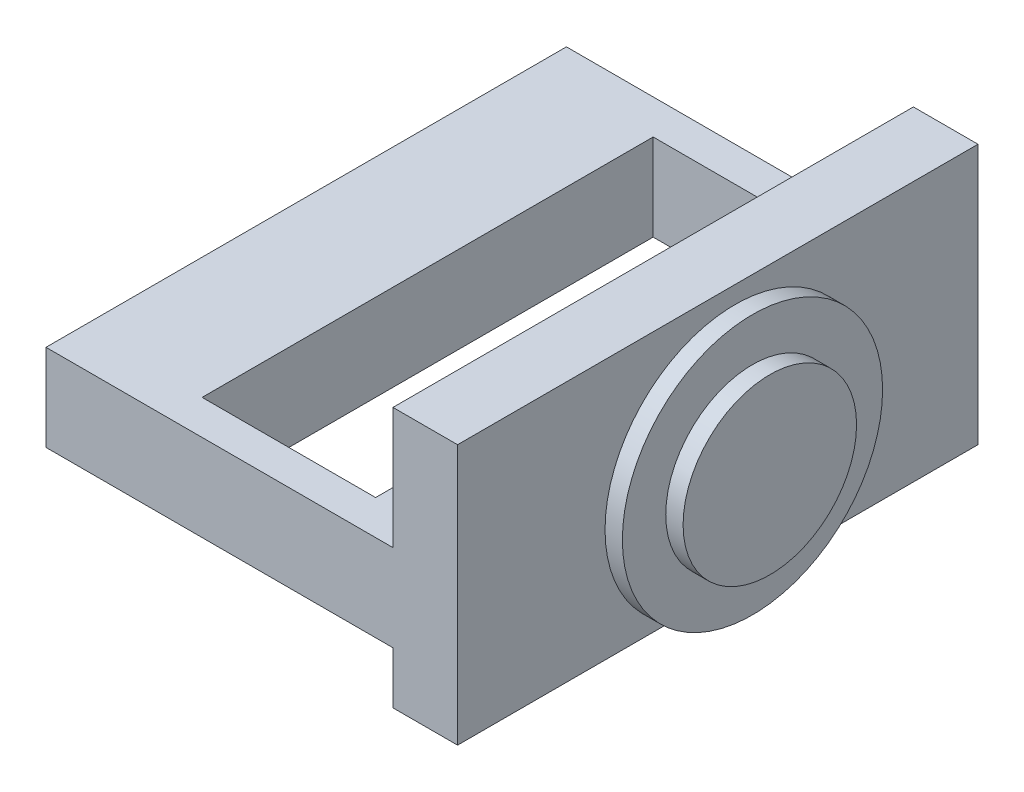
from build123d import *

# Parameters (mm, degrees)
BOSS_EXTRUDE1_DEPTH = 30
SKETCH3_W           = 10
SKETCH3_H           = 26
CUT_EXTRUDE1_DEPTH  = 5
SKETCH6_R           = 5
BOSS_EXTRUDE2_DEPTH = 1
SKETCH7_R           = 7.5
BOSS_EXTRUDE3_DEPTH = 1
SKETCH8_R           = 5
BOSS_EXTRUDE4_DEPTH = 1


with BuildPart() as part:
    # Sketch1 → Boss-Extrude1 (new body)
    with BuildSketch(Plane.XY):
        Polygon((-14.164814983, 3.151006711), (-14.164814983, -1.848993289), (5.835185017, -1.848993289), (5.835185017, -4.848993289), (9.560017232, -4.848993289), (9.560017232, 10.151006711), (5.835185017, 10.151006711), (5.835185017, 3.151006711), align=None)
    extrude(amount=BOSS_EXTRUDE1_DEPTH)

    # Sketch3 → Cut-Extrude1 (cut)
    with BuildSketch(Plane(origin=(0, 3.151006711, 0), x_dir=(1, 0, 0), z_dir=(0, 1, 0))):
        with Locations((-2.164814983, -15)):
            Rectangle(SKETCH3_W, SKETCH3_H)
    extrude(amount=-CUT_EXTRUDE1_DEPTH, mode=Mode.SUBTRACT)

    # Sketch6 → Boss-Extrude2 (add)
    with BuildSketch(Plane(origin=(9.560017232, 0, 0), x_dir=(0, 0, -1), z_dir=(1, 0, 0))):
        with Locations((-15, 2.651006711)):
            Circle(SKETCH6_R)
    extrude(amount=BOSS_EXTRUDE2_DEPTH)

    # Sketch7 → Boss-Extrude3 (add)
    with BuildSketch(Plane(origin=(10.560017232, 0, 0), x_dir=(0, 0, -1), z_dir=(1, 0, 0))):
        with Locations((-15, 2.651006711)):
            Circle(SKETCH7_R)
    extrude(amount=BOSS_EXTRUDE3_DEPTH)

    # Sketch8 → Boss-Extrude4 (add)
    with BuildSketch(Plane(origin=(11.560017232, 0, 0), x_dir=(0, 0, -1), z_dir=(1, 0, 0))):
        with Locations((-15, 2.651006711)):
            Circle(SKETCH8_R)
    extrude(amount=BOSS_EXTRUDE4_DEPTH)


solid = part.part
